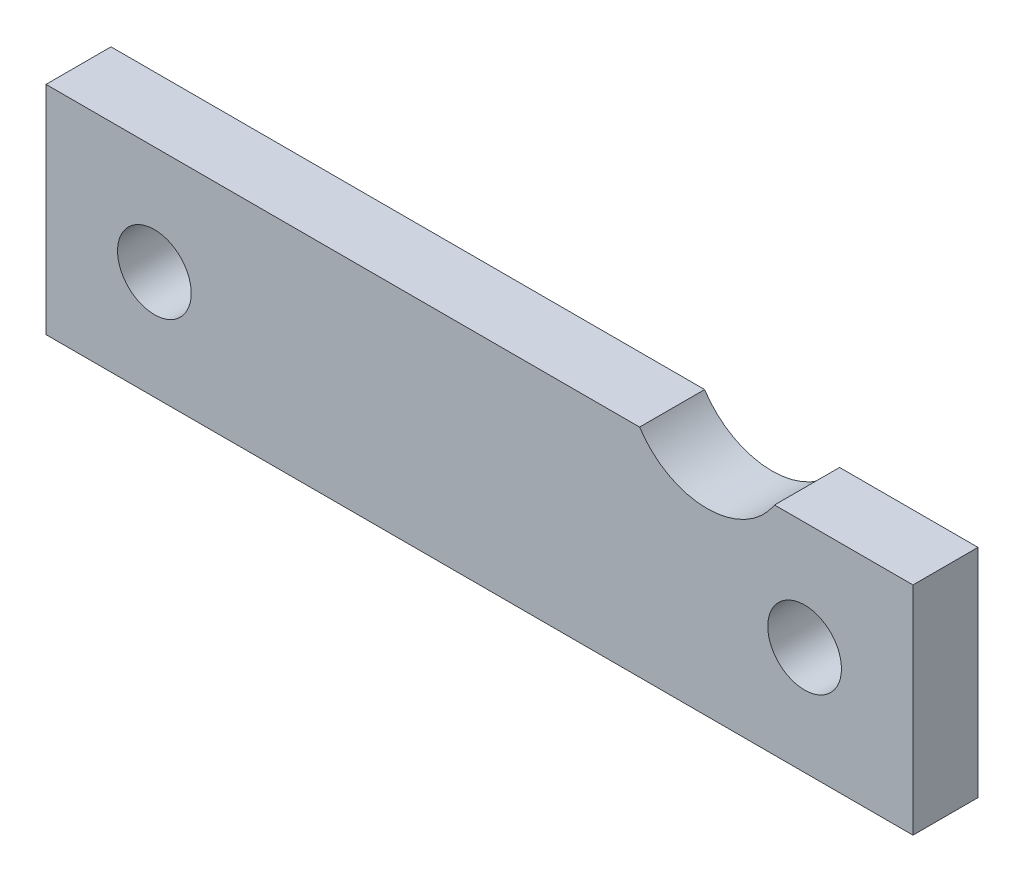
from build123d import *

# Parameters (mm, degrees)
MAIN_PROFILE_SKETCH_R = 1.7
MAIN_EXTRUSION_DEPTH  = 3


with BuildPart() as part:
    # Main Profile Sketch → Main Extrusion (new body)
    with BuildSketch(Plane.XY.offset(44.5)):
        with BuildLine():
            Line((35, 41.5), (62.387123517, 41.5))
            ThreePointArc((62.387123517, 41.5), (65.5, 39.8), (68.612876483, 41.5))
            Line((68.612876483, 41.5), (75, 41.5))
            Line((75, 41.5), (75, 31.5))
            Line((75, 31.5), (35, 31.5))
            Line((35, 31.5), (35, 41.5))
        make_face()
        with Locations((40, 36.5)):
            Circle(MAIN_PROFILE_SKETCH_R, mode=Mode.SUBTRACT)
        with Locations((70, 36.5)):
            Circle(MAIN_PROFILE_SKETCH_R, mode=Mode.SUBTRACT)
    extrude(amount=-MAIN_EXTRUSION_DEPTH)


solid = part.part
